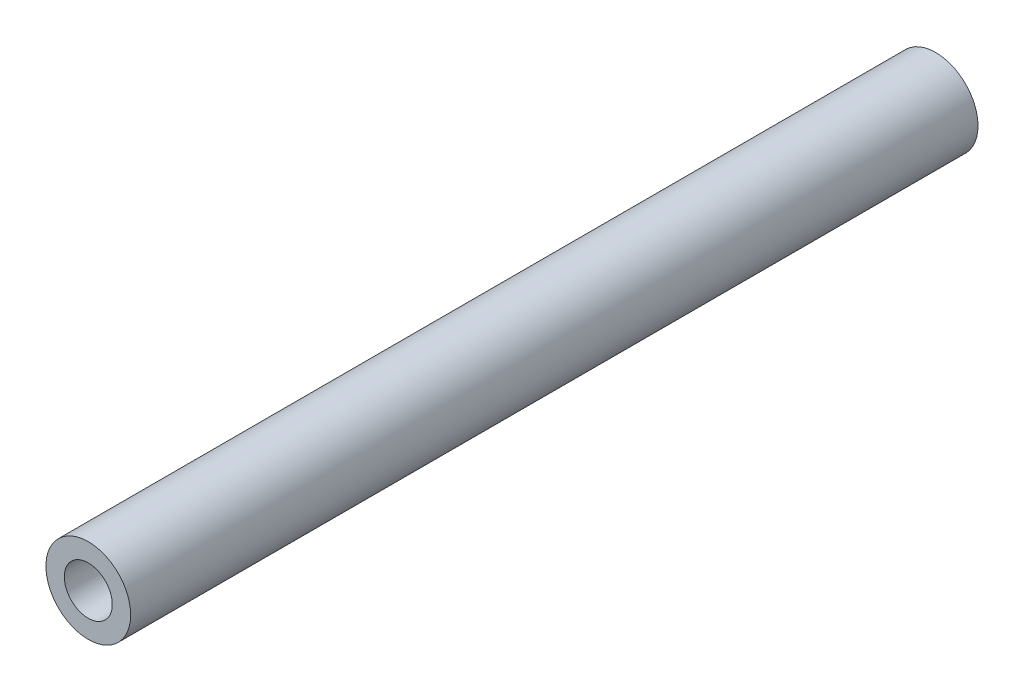
from build123d import *

# Parameters (mm, degrees)
SKETCH_1_R         = 3
EXTRUDE_1_DEPTH    = 60
HOLE_WIZARD_M3_1_D = 3.4


with BuildPart() as part:
    # ｽｹｯﾁ1 → ﾎﾞｽ - 押し出し1 (new body)
    with BuildSketch(Plane.XY):
        Circle(SKETCH_1_R)
    extrude(amount=EXTRUDE_1_DEPTH)

    # M3 すきま穴1 (through all)
    with Locations(Plane(origin=(0, 0, 0), x_dir=(-1, 0, 0), z_dir=(0, 0, -1))):
        with Locations((0, 0)):
            Hole(HOLE_WIZARD_M3_1_D / 2)


solid = part.part
